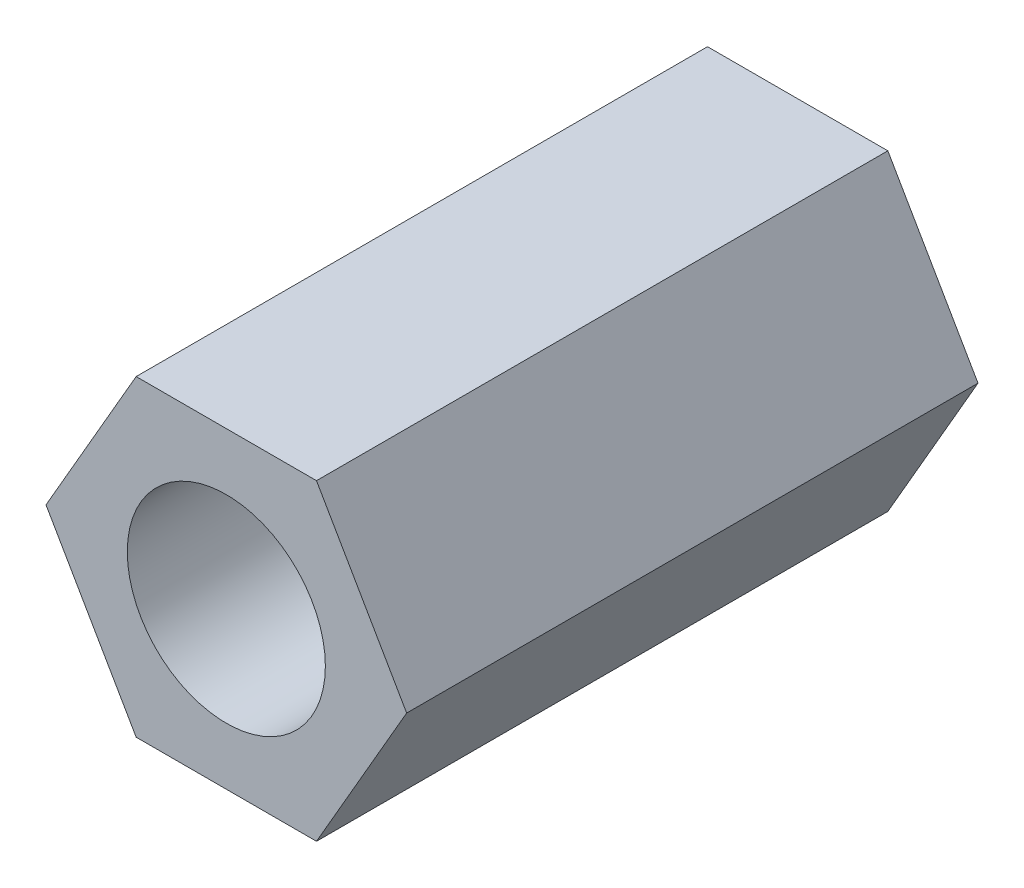
from build123d import *

# Parameters (mm, degrees)
EXTRUDE_1_DEPTH     = 75
SKETCH_2_R          = 13
CUT_EXTRUDE_1_DEPTH = 46
SKETCH_3_R          = 11.1
CUT_EXTRUDE_2_DEPTH = 63


with BuildPart() as part:
    # 草图1 → 凸台-拉伸1 (new body)
    with BuildSketch(Plane.XY):
        Polygon((-23.671361037, 0), (-11.835680518, -20.5), (11.835680518, -20.5), (23.671361037, 0), (11.835680518, 20.5), (-11.835680518, 20.5), align=None)
    extrude(amount=EXTRUDE_1_DEPTH)

    # 草图2 → 切除-拉伸1 (cut)
    with BuildSketch(Plane.XY.offset(75)):
        Circle(SKETCH_2_R)
    extrude(amount=-CUT_EXTRUDE_1_DEPTH, mode=Mode.SUBTRACT)

    # 草图3 → 切除-拉伸2 (cut)
    with BuildSketch(Plane.XY.offset(29)):
        Circle(SKETCH_3_R)
    extrude(amount=-CUT_EXTRUDE_2_DEPTH, mode=Mode.SUBTRACT)


solid = part.part
